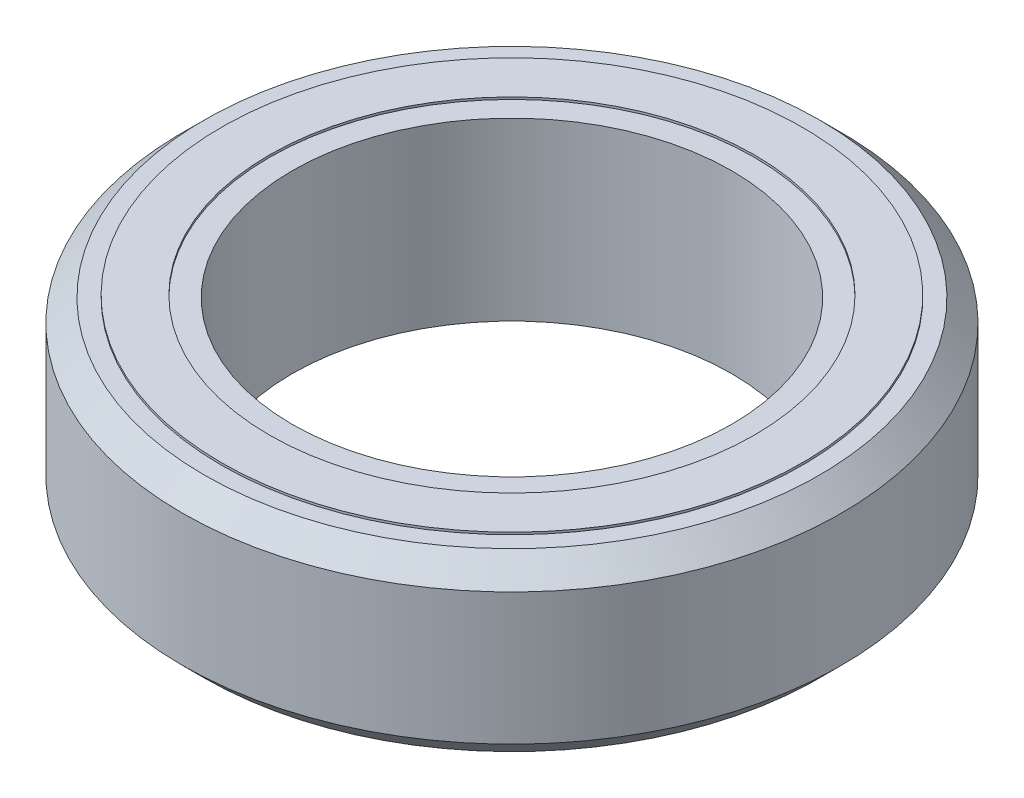
from build123d import *

# Parameters (mm, degrees)
CROQUIS1_R              = 7.5
CROQUIS1_R_2            = 5
SALIENTE_EXTRUIR1_DEPTH = 2
CHAFL_N1_SIZE           = 0.5
CROQUIS2_R              = 6.611271869
CROQUIS2_R_2            = 5.520857639
SALIENTE_EXTRUIR2_DEPTH = 2.05


with BuildPart() as part:
    # Croquis1 → Saliente-Extruir1 (new, symmetric)
    with BuildSketch(Plane(origin=(0, 0, 0), x_dir=(1, 0, 0), z_dir=(0, 1, 0))):
        with Locations(Location((0, 0, 0), (0, 0, 270))):
            Circle(CROQUIS1_R)
        with Locations(Location((0, 0, 0), (0, 0, 270))):
            Circle(CROQUIS1_R_2, mode=Mode.SUBTRACT)
    extrude(amount=SALIENTE_EXTRUIR1_DEPTH, both=True)

    # Chaflán1
    chafl_n1_edges = [part.edges().sort_by_distance(p)[0] for p in [
        (0, -2, -7.5),
        (0, 2, -7.5),
    ]]
    chamfer(chafl_n1_edges, length=CHAFL_N1_SIZE)

    # Croquis2 → Saliente-Extruir2 (add, symmetric)
    with BuildSketch(Plane(origin=(0, 0, 0), x_dir=(1, 0, 0), z_dir=(0, 1, 0))):
        with Locations(Location((0, 0, 0), (0, 0, 270))):
            Circle(CROQUIS2_R)
        with Locations(Location((0, 0, 0), (0, 0, 270))):
            Circle(CROQUIS2_R_2, mode=Mode.SUBTRACT)
    extrude(amount=SALIENTE_EXTRUIR2_DEPTH, both=True)


solid = part.part
